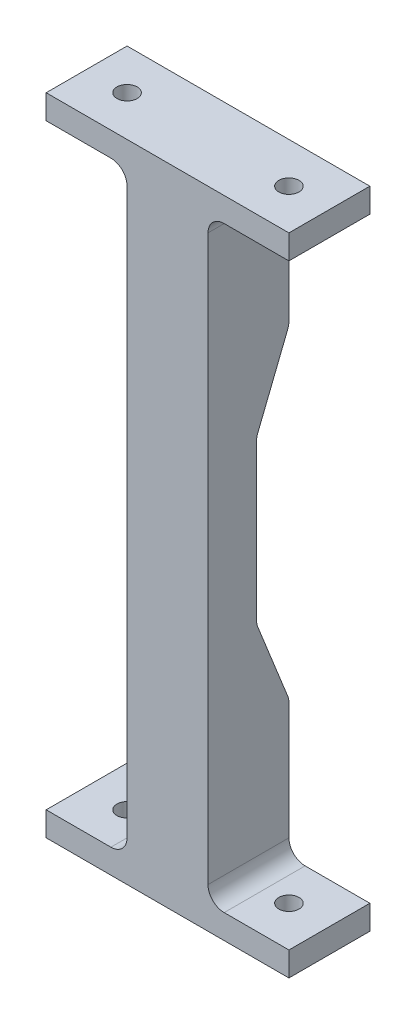
from build123d import *

# Parameters (mm, degrees)
BOSS_EXTRUDE1_DEPTH = 6.35
SKETCH2_R           = 1.5875
MOUNT_HOLES_DEPTH   = 12.7
FILLET1_R           = 2.54
CUT_EXTRUDE1_DEPTH  = 105.599497571
FILLET2_R           = 2.54


with BuildPart() as part:
    # Sketch1 → Boss-Extrude1 (new, symmetric)
    with BuildSketch(Plane.XY):
        Polygon((19.05, 0), (-19.05, 0), (-19.05, 3.81), (-6.35, 3.81), (-6.35, 97.4598), (-19.05, 97.4598), (-19.05, 101.2698), (19.05, 101.2698), (19.05, 97.4598), (6.35, 97.4598), (6.35, 3.81), (19.05, 3.81), align=None)
    extrude(amount=BOSS_EXTRUDE1_DEPTH, both=True)

    # Sketch2 → Mount_Holes (cut)
    with BuildSketch(Plane(origin=(0, 3.81, 0), x_dir=(1, 0, 0), z_dir=(0, 1, 0))):
        with Locations(Location((12.7, 0, 0), (0, 0, 180))):
            Circle(SKETCH2_R)
        with Locations(Location((-12.7, 0, 0), (0, 0, 180))):
            Circle(SKETCH2_R)
    mount_holes = extrude(amount=-MOUNT_HOLES_DEPTH, mode=Mode.SUBTRACT)

    # Mirror1: Mount_Holes across plane
    add(mount_holes.mirror(Plane.ZX.offset(50.6349)), mode=Mode.SUBTRACT)

    # Fillet1
    fillet1_edges = [part.edges().sort_by_distance(p)[0] for p in [
        (-6.35, 3.81, 0),
        (-6.35, 97.4598, 0),
        (6.35, 97.4598, 0),
        (6.35, 3.81, 0),
    ]]
    fillet(fillet1_edges, radius=FILLET1_R)

    # Sketch3 → Cut-Extrude1 (cut, through all)
    with BuildSketch(Plane.ZY.offset(6.35)):
        Polygon((-6.35, 25.2349), (-6.35, 76.0349), (-1.27, 63.3349), (-1.27, 37.9349), align=None)
    extrude(amount=-CUT_EXTRUDE1_DEPTH, mode=Mode.SUBTRACT)

    # Fillet2
    fillet2_edges = [part.edges().sort_by_distance(p)[0] for p in [
        (0, 25.2349, -6.35),
        (0, 76.0349, -6.35),
        (0, 63.3349, -1.27),
        (0, 37.9349, -1.27),
    ]]
    fillet(fillet2_edges, radius=FILLET2_R)


solid = part.part
